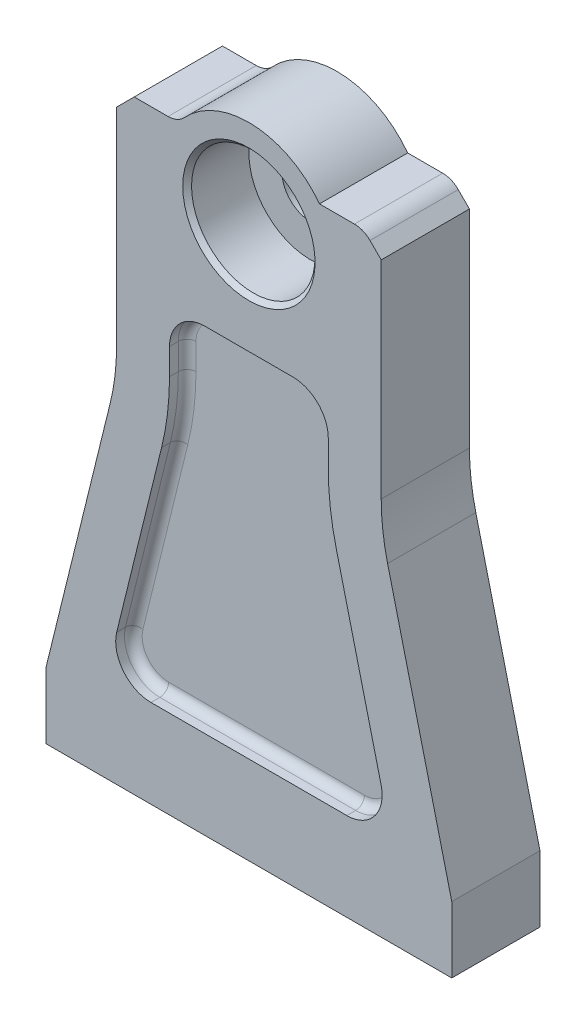
from build123d import *

# Parameters (mm, degrees)
SKETCH1_R                         = 6.5
BOSS_EXTRUDE1_DEPTH               = 10
SKETCH2_R                         = 14
CUT_EXTRUDE1_DEPTH                = 14
CHAMFER1_SIZE                     = 1
CHAMFER2_SIZE                     = 4
FILLET1_R                         = 5
CUT_EXTRUDE2_DEPTH                = 4
FILLET2_R                         = 2
FILLET2_OF_MIRROR1_R              = 2
M10X1_25_TAPPED_HOLE1_D           = 8.8
M10X1_25_TAPPED_HOLE1_DEPTH       = 20
M10X1_25_TAPPED_HOLE1_CSINK_D     = 10
M10X1_25_TAPPED_HOLE1_CSINK_ANGLE = 90
M10X1_25_TAPPED_HOLE1_TIP         = 2.643786724


with BuildPart() as part:
    # Sketch1 → Boss-Extrude1 (new, symmetric)
    with BuildSketch(Plane.XY):
        with BuildLine():
            Line((-46, 0), (46, 0))
            Line((46, 0), (46, 15))
            Line((46, 15), (31.449256053, 74.112397284))
            ThreePointArc((31.449256053, 74.112397284), (30.363636327, 80.044097084), (30, 86.06334964))
            Line((30, 86.06334964), (30, 137))
            Line((30, 137), (16, 137))
            ThreePointArc((16, 137), (0, 145), (-16, 137))
            Line((-16, 137), (-30, 137))
            Line((-30, 137), (-30, 86.06334964))
            ThreePointArc((-30, 86.06334964), (-30.363636327, 80.044097084), (-31.449256053, 74.112397284))
            Line((-31.449256053, 74.112397284), (-46, 15))
            Line((-46, 15), (-46, 0))
        make_face()
        with Locations((0, 125)):
            Circle(SKETCH1_R, mode=Mode.SUBTRACT)
    extrude(amount=BOSS_EXTRUDE1_DEPTH, both=True)

    # Sketch2 → Cut-Extrude1 (cut)
    with BuildSketch(Plane.XY.offset(10)):
        with Locations((0, 125)):
            Circle(SKETCH2_R)
    extrude(amount=-CUT_EXTRUDE1_DEPTH, mode=Mode.SUBTRACT)

    # Chamfer1
    chamfer1_edges = [part.edges().sort_by_distance(p)[0] for p in [
        (-14, 125, 10),
    ]]
    chamfer(chamfer1_edges, length=CHAMFER1_SIZE)

    # Chamfer2
    chamfer2_edges = [part.edges().sort_by_distance(p)[0] for p in [
        (-30, 137, 0),
        (30, 137, 0),
    ]]
    chamfer(chamfer2_edges, length=CHAMFER2_SIZE)

    # Fillet1
    fillet1_edges = [part.edges().sort_by_distance(p)[0] for p in [
        (-16, 137, 0),
        (26, 137, 0),
    ]]
    fillet(fillet1_edges, radius=FILLET1_R)

    # Sketch3 → Cut-Extrude2 (cut)
    with BuildSketch(Plane.XY.offset(10)):
        with BuildLine():
            Line((-18, 92), (-18, 86.06334964))
            ThreePointArc((-18, 86.06334964), (-18.450909046, 78.59947647), (-19.797077506, 71.244168718))
            Line((-19.797077506, 71.244168718), (-29.971112298, 29.912152377))
            ThreePointArc((-29.971112298, 29.912152377), (-28.49970745, 23.065287193), (-22.202993266, 20))
            Line((-22.202993266, 20), (22.202993266, 20))
            ThreePointArc((22.202993266, 20), (28.49970745, 23.065287193), (29.971112298, 29.912152377))
            Line((29.971112298, 29.912152377), (19.797077506, 71.244168718))
            ThreePointArc((19.797077506, 71.244168718), (18.450909046, 78.59947647), (18, 86.06334964))
            Line((18, 86.06334964), (18, 92))
            ThreePointArc((18, 92), (15.656854249, 97.656854249), (10, 100))
            Line((10, 100), (-10, 100))
            ThreePointArc((-10, 100), (-15.656854249, 97.656854249), (-18, 92))
        make_face()
    cut_extrude2 = extrude(amount=-CUT_EXTRUDE2_DEPTH, mode=Mode.SUBTRACT)

    # Fillet2
    fillet2_edges = [part.edges().sort_by_distance(p)[0] for p in [
        (15.656854249, 97.656854249, 6),
        (18, 89.03167482, 6),
        (18.450909046, 78.59947647, 6),
        (24.884094902, 50.578160548, 6),
        (28.49970745, 23.065287193, 6),
        (0, 20, 6),
        (-28.49970745, 23.065287193, 6),
        (-24.884094902, 50.578160548, 6),
        (-18.450909046, 78.59947647, 6),
        (-18, 89.03167482, 6),
        (-15.656854249, 97.656854249, 6),
        (0, 100, 6),
    ]]
    fillet(fillet2_edges, radius=FILLET2_R)

    # Mirror1: Cut-Extrude2 across plane
    add(cut_extrude2.mirror(Plane.XY), mode=Mode.SUBTRACT)

    # Fillet2 of Mirror1
    fillet2_of_mirror1_edges = [part.edges().sort_by_distance(p)[0] for p in [
        (15.656854249, 97.656854249, -6),
        (18, 89.03167482, -6),
        (18.450909046, 78.59947647, -6),
        (24.884094902, 50.578160548, -6),
        (28.49970745, 23.065287193, -6),
        (0, 20, -6),
        (-28.49970745, 23.065287193, -6),
        (-24.884094902, 50.578160548, -6),
        (-18.450909046, 78.59947647, -6),
        (-18, 89.03167482, -6),
        (-15.656854249, 97.656854249, -6),
        (0, 100, -6),
    ]]
    fillet(fillet2_of_mirror1_edges, radius=FILLET2_OF_MIRROR1_R)

    # M10x1.25 Tapped Hole1
    with Locations(Plane(origin=(0, 0, 0), x_dir=(-1, 0, 0), z_dir=(0, -1, 0))):
        with Locations((-30, 0), (30, 0)):
            CounterSinkHole(M10X1_25_TAPPED_HOLE1_D / 2, M10X1_25_TAPPED_HOLE1_CSINK_D / 2, depth=M10X1_25_TAPPED_HOLE1_DEPTH, counter_sink_angle=M10X1_25_TAPPED_HOLE1_CSINK_ANGLE)
            with Locations((0, 0, -(M10X1_25_TAPPED_HOLE1_DEPTH + M10X1_25_TAPPED_HOLE1_TIP / 2))):  # 118° drill point
                Cone(0, M10X1_25_TAPPED_HOLE1_D / 2, M10X1_25_TAPPED_HOLE1_TIP, mode=Mode.SUBTRACT)


solid = part.part
